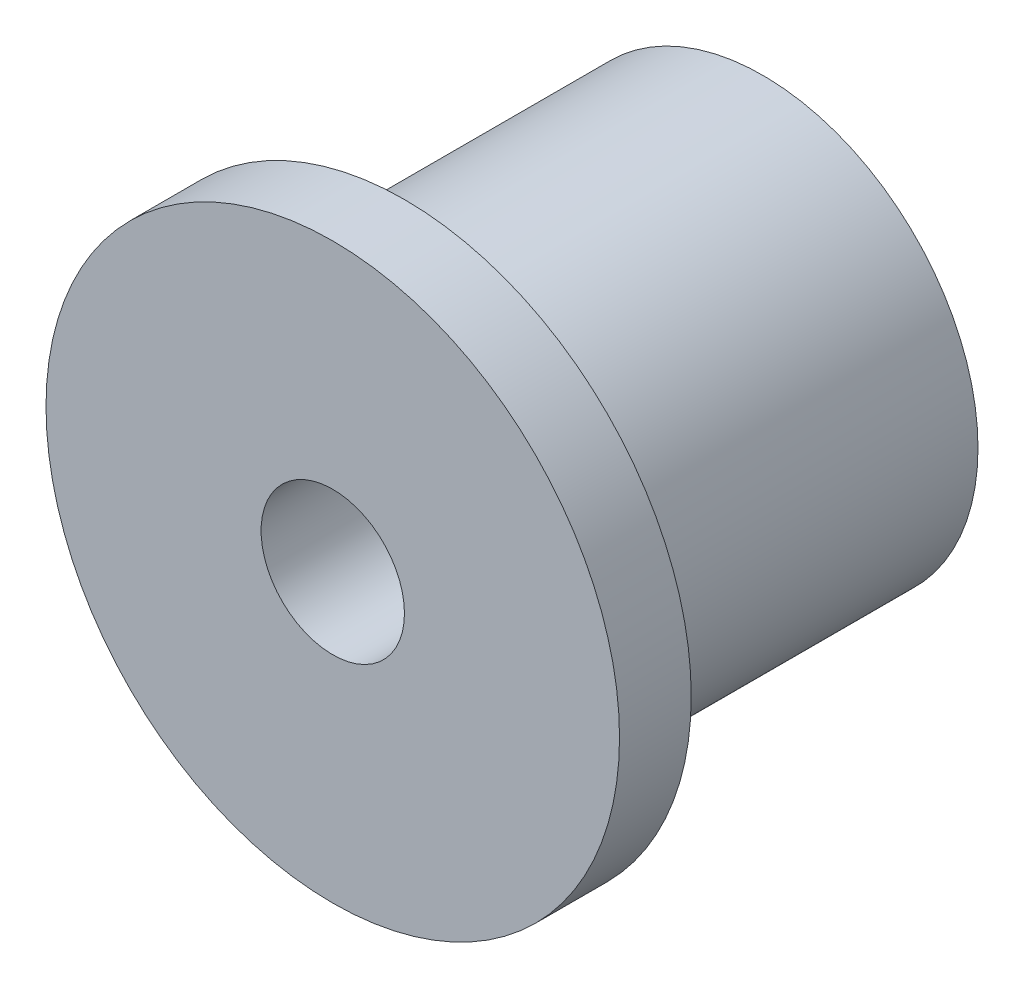
from build123d import *

# Parameters (mm, degrees)
SKETCH1_R           = 100
SKETCH1_R_2         = 25
BOSS_EXTRUDE2_DEPTH = 25
BOSS_EXTRUDE3_START = -125
SKETCH1_4_R         = 75
SKETCH1_4_R_2       = 25
BOSS_EXTRUDE3_DEPTH = 125


with BuildPart() as part:
    # Sketch1 → Boss-Extrude2 (new body)
    with BuildSketch(Plane.XY):
        Circle(SKETCH1_R)
        Circle(SKETCH1_R_2, mode=Mode.SUBTRACT)
    extrude(amount=BOSS_EXTRUDE2_DEPTH)

    # Sketch1<4> → Boss-Extrude3 (add)
    with BuildSketch(Plane.XY.offset(BOSS_EXTRUDE3_START)):
        Circle(SKETCH1_4_R)
        Circle(SKETCH1_4_R_2, mode=Mode.SUBTRACT)
    extrude(amount=BOSS_EXTRUDE3_DEPTH)


solid = part.part
